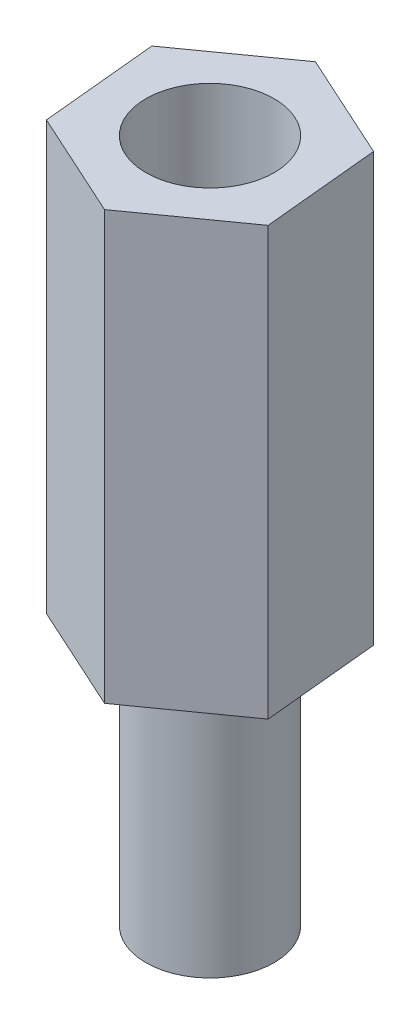
from build123d import *

# Parameters (mm, degrees)
SKETCH_1_R          = 1.5
EXTRUDE_1_DEPTH     = 6
EXTRUDE_2_DEPTH     = 10
CUT_EXTRUDE_START   = -5
SKETCH_3_R          = 1.5
CUT_EXTRUDE_1_DEPTH = 5


with BuildPart() as part:
    # 草图1 → 凸台-拉伸1 (new body)
    with BuildSketch(Plane(origin=(0, 0, 0), x_dir=(1, 0, 0), z_dir=(0, 1, 0))):
        with Locations(Location((0, 0, 0), (0, 0, 270))):
            Circle(SKETCH_1_R)
    extrude(amount=EXTRUDE_1_DEPTH)

    # 草图2 → 凸台-拉伸2 (add)
    with BuildSketch(Plane(origin=(0, 6, 0), x_dir=(1, 0, 0), z_dir=(0, 1, 0))):
        Polygon((2.495784313, -1.136615149), (2.23222975, 1.593105043), (-0.263554563, 2.729720192), (-2.495784313, 1.136615149), (-2.23222975, -1.593105043), (0.263554563, -2.729720192), align=None)
    extrude(amount=EXTRUDE_2_DEPTH)

    # 草图3 → 切除-拉伸1 (cut)
    with BuildSketch(Plane(origin=(0, 16, 0), x_dir=(1, 0, 0), z_dir=(0, 1, 0)).offset(CUT_EXTRUDE_START)):
        with Locations(Location((0, 0, 0), (0, 0, 270))):
            Circle(SKETCH_3_R)
    extrude(amount=CUT_EXTRUDE_1_DEPTH, mode=Mode.SUBTRACT)


solid = part.part
